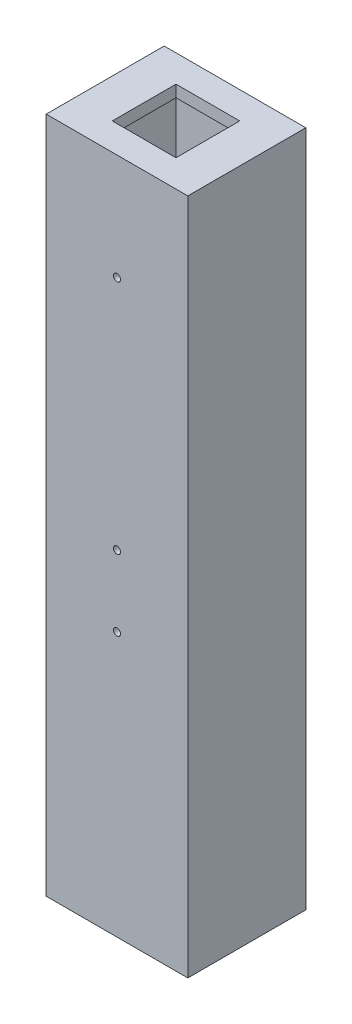
from build123d import *

# Parameters (mm, degrees)
SKETCH_1_W          = 12
SKETCH_1_H          = 10
SKETCH_1_W_2        = 6.2
SKETCH_1_H_2        = 6.2
EXTRUDE_1_DEPTH     = 54
EXTRUDE_START       = 54
SKETCH_1_3_W        = 12
SKETCH_1_3_H        = 10
SKETCH_1_3_W_2      = 6.2
SKETCH_1_3_H_2      = 6.2
SKETCH_1_3_W_3      = 5.4
SKETCH_1_3_H_3      = 5.4
EXTRUDE_2_DEPTH     = 1
SKETCH_3_W          = 12
SKETCH_3_H          = 10
SKETCH_3_W_2        = 7.2
SKETCH_3_H_2        = 7.2
EXTRUDE_3_DEPTH     = 3.4
SKETCH_2_R          = 0.3
CUT_EXTRUDE_1_DEPTH = 2
SKETCH_7_R          = 0.3
CUT_EXTRUDE_2_DEPTH = 56.244909268


with BuildPart() as part:
    # 草图1 → 凸台-拉伸1 (new body)
    with BuildSketch(Plane(origin=(0, 0, 0), x_dir=(1, 0, 0), z_dir=(0, 1, 0))):
        Rectangle(SKETCH_1_W, SKETCH_1_H)
        Rectangle(SKETCH_1_W_2, SKETCH_1_H_2, mode=Mode.SUBTRACT)
    extrude(amount=EXTRUDE_1_DEPTH)

    # 草图1<3> → 凸台-拉伸2 (add)
    # profile 1 of 2: a face of its own
    with BuildSketch(Plane(origin=(0, 0, 0), x_dir=(1, 0, 0), z_dir=(0, 1, 0)).offset(EXTRUDE_START)):
        Rectangle(SKETCH_1_3_W, SKETCH_1_3_H)
        Rectangle(SKETCH_1_3_W_2, SKETCH_1_3_H_2, mode=Mode.SUBTRACT)
    # profile 2 of 2: a face of its own
    with BuildSketch(Plane(origin=(0, 0, 0), x_dir=(1, 0, 0), z_dir=(0, 1, 0)).offset(EXTRUDE_START)):
        Rectangle(SKETCH_1_3_W_2, SKETCH_1_3_H_2)
        Rectangle(SKETCH_1_3_W_3, SKETCH_1_3_H_3, mode=Mode.SUBTRACT)
    extrude(amount=-EXTRUDE_2_DEPTH)

    # 草图3 → 凸台-拉伸3 (add)
    with BuildSketch(Plane.XZ):
        Rectangle(SKETCH_3_W, SKETCH_3_H)
        Rectangle(SKETCH_3_W_2, SKETCH_3_H_2, mode=Mode.SUBTRACT)
    extrude(amount=EXTRUDE_3_DEPTH)

    # 草图2 → 切除-拉伸1 (cut)
    with BuildSketch(Plane.XZ.offset(3.4)):
        with Locations(Location((-4.5, 3.5, 0), (0, 0, 270))):
            Circle(SKETCH_2_R)
        with Locations(Location((4.5, -3.5, 0), (0, 0, 270))):
            Circle(SKETCH_2_R)
        with Locations(Location((4.5, 3.5, 0), (0, 0, 270))):
            Circle(SKETCH_2_R)
        with Locations(Location((-4.5, -3.5, 0), (0, 0, 270))):
            Circle(SKETCH_2_R)
    extrude(amount=-CUT_EXTRUDE_1_DEPTH, mode=Mode.SUBTRACT)

    # 草图7 → 切除-拉伸2 (cut, through all)
    with BuildSketch(Plane(origin=(0, 0, -5), x_dir=(-1, 0, 0), z_dir=(0, 0, -1))):
        with Locations((0, 19)):
            Circle(SKETCH_7_R)
        with Locations((0, 25)):
            Circle(SKETCH_7_R)
        with Locations((0, 45)):
            Circle(SKETCH_7_R)
    extrude(amount=-CUT_EXTRUDE_2_DEPTH, mode=Mode.SUBTRACT)


solid = part.part
